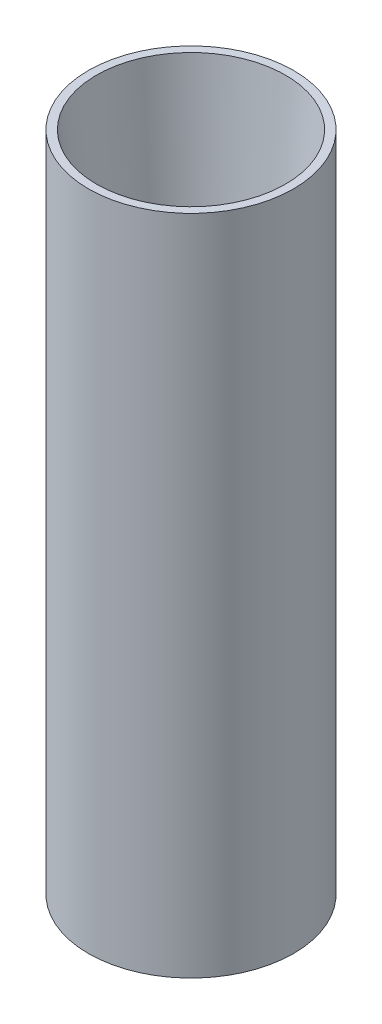
from build123d import *

# Parameters (mm, degrees)
SKETCH1_R           = 12.7
BOSS_EXTRUDE1_DEPTH = 82
SKETCH2_R           = 11.7
CUT_EXTRUDE1_DEPTH  = 25.4
CUT_EXTRUDE1_DRAFT  = -5
SKETCH3_R           = 10.7
CUT_EXTRUDE2_DEPTH  = 53.38
SKETCH4_R           = 11.2
CUT_EXTRUDE3_DEPTH  = 81.801413354


with BuildPart() as part:
    # Sketch1 → Boss-Extrude1 (new body)
    with BuildSketch(Plane(origin=(0, 0, 0), x_dir=(1, 0, 0), z_dir=(0, 1, 0))):
        with Locations(Location((0, 0, 0), (0, 0, 270))):
            Circle(SKETCH1_R)
    extrude(amount=-BOSS_EXTRUDE1_DEPTH)


with BuildPart() as cut_extrude1_tool:
    # Sketch2 → Cut-Extrude1 (with draft: the straight prism first)
    with BuildSketch(Plane(origin=(0, 0, 0), x_dir=(1, 0, 0), z_dir=(0, 1, 0))):
        Circle(SKETCH2_R)
    extrude(amount=-CUT_EXTRUDE1_DEPTH)
    # Cut-Extrude1: the draft: its side faces are tilted about the plane it starts from
    cut_extrude1_sides = [cut_extrude1_tool.faces().sort_by_distance(p)[0] for p in [
        (-11.7, -12.7, 0),
    ]]
    draft(cut_extrude1_sides, Plane(origin=(0, 0, 0), x_dir=(1, 0, 0), z_dir=(0, 1, 0)), CUT_EXTRUDE1_DRAFT)


with BuildPart() as part_1:
    add(part.part)

    # Cut-Extrude1: cut by cut_extrude1_tool
    add(cut_extrude1_tool.part, mode=Mode.SUBTRACT)

    # Sketch3 → Cut-Extrude2 (cut)
    with BuildSketch(Plane(origin=(0, -25.4, 0), x_dir=(1, 0, 0), z_dir=(0, 1, 0))):
        with Locations(Location((0, 0, 0), (0, 0, 270))):
            Circle(SKETCH3_R)
    extrude(amount=-CUT_EXTRUDE2_DEPTH, mode=Mode.SUBTRACT)

    # Sketch4 → Cut-Extrude3 (cut, through all)
    with BuildSketch(Plane(origin=(0, -78.78, 0), x_dir=(1, 0, 0), z_dir=(0, 1, 0))):
        with Locations(Location((0, 0, 0), (0, 0, 270))):
            Circle(SKETCH4_R)
    extrude(amount=-CUT_EXTRUDE3_DEPTH, mode=Mode.SUBTRACT)


solid = part_1.part
